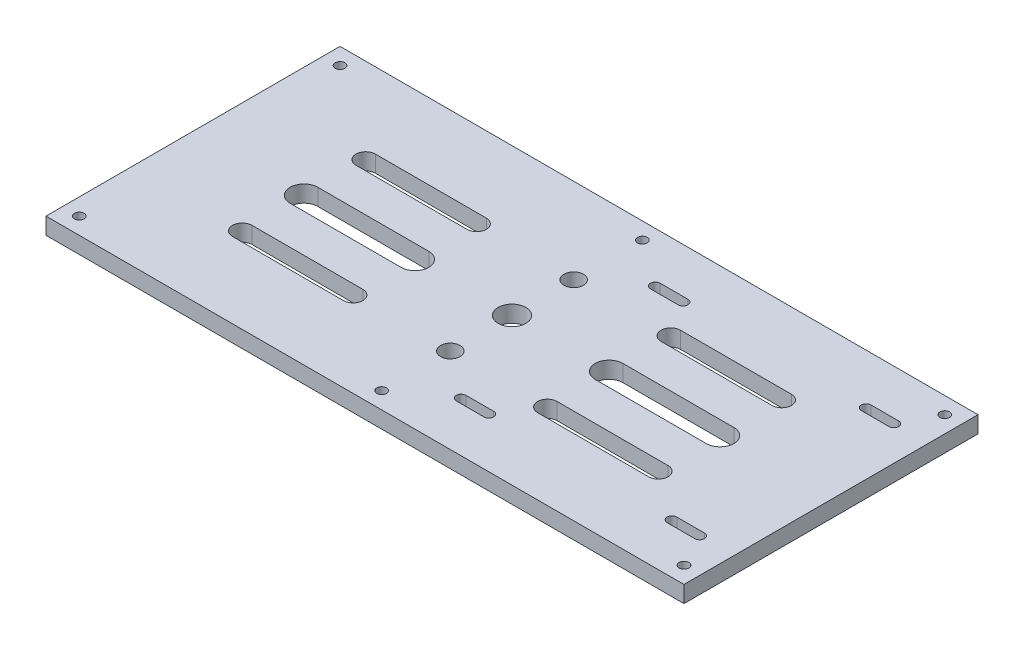
from build123d import *

# Parameters (mm, degrees)
SKETCH1_W           = 230
SKETCH1_H           = 106
SKETCH1_R           = 5
SKETCH1_R_2         = 3.5
SKETCH1_R_3         = 1.75
BOSS_EXTRUDE1_DEPTH = 6


with BuildPart() as part:
    # Sketch1 → Boss-Extrude1 (new body)
    with BuildSketch(Plane(origin=(0, 0, 0), x_dir=(1, 0, 0), z_dir=(0, 1, 0))):
        Rectangle(SKETCH1_W, SKETCH1_H)
        with Locations(Location((0, 0, 0), (0, 0, 270))):
            Circle(SKETCH1_R, mode=Mode.SUBTRACT)
        with Locations(Location((0, 22.25, 0), (0, 0, 270))):
            Circle(SKETCH1_R_2, mode=Mode.SUBTRACT)
        with Locations(Location((0, -22.25, 0), (0, 0, 90))):
            Circle(SKETCH1_R_2, mode=Mode.SUBTRACT)
        with Locations(Location((109, 47, 0), (0, 0, 270))):
            Circle(SKETCH1_R_3, mode=Mode.SUBTRACT)
        with Locations(Location((109, -47, 0), (0, 0, 90))):
            Circle(SKETCH1_R_3, mode=Mode.SUBTRACT)
        with Locations(Location((-109, -47, 0), (0, 0, 270))):
            Circle(SKETCH1_R_3, mode=Mode.SUBTRACT)
        with Locations(Location((-109, 47, 0), (0, 0, 90))):
            Circle(SKETCH1_R_3, mode=Mode.SUBTRACT)
        with Locations(Location((0, 47, 0), (0, 0, 270))):
            Circle(SKETCH1_R_3, mode=Mode.SUBTRACT)
        with Locations(Location((0, -47, 0), (0, 0, 90))):
            Circle(SKETCH1_R_3, mode=Mode.SUBTRACT)
        with BuildLine():
            Line((35, 5), (75, 5))
            ThreePointArc((75, 5), (80, 0), (75, -5))
            Line((75, -5), (35, -5))
            ThreePointArc((35, -5), (30, 0), (35, 5))
        make_face(mode=Mode.SUBTRACT)
        with BuildLine():
            Line((35, 18.75), (75, 18.75))
            ThreePointArc((75, 18.75), (78.5, 22.25), (75, 25.75))
            Line((75, 25.75), (35, 25.75))
            ThreePointArc((35, 25.75), (31.5, 22.25), (35, 18.75))
        make_face(mode=Mode.SUBTRACT)
        with BuildLine():
            Line((16.66, -33.25), (26.66, -33.25))
            ThreePointArc((26.66, -33.25), (28.41, -35), (26.66, -36.75))
            Line((26.66, -36.75), (16.66, -36.75))
            ThreePointArc((16.66, -36.75), (14.91, -35), (16.66, -33.25))
        make_face(mode=Mode.SUBTRACT)
        with BuildLine():
            Line((16.66, 36.75), (26.66, 36.75))
            ThreePointArc((26.66, 36.75), (28.41, 35), (26.66, 33.25))
            Line((26.66, 33.25), (16.66, 33.25))
            ThreePointArc((16.66, 33.25), (14.91, 35), (16.66, 36.75))
        make_face(mode=Mode.SUBTRACT)
        with BuildLine():
            Line((102.66, -33.25), (92.66, -33.25))
            ThreePointArc((92.66, -33.25), (90.91, -35), (92.66, -36.75))
            Line((92.66, -36.75), (102.66, -36.75))
            ThreePointArc((102.66, -36.75), (104.41, -35), (102.66, -33.25))
        make_face(mode=Mode.SUBTRACT)
        with BuildLine():
            Line((102.66, 33.25), (92.66, 33.25))
            ThreePointArc((92.66, 33.25), (90.91, 35), (92.66, 36.75))
            Line((92.66, 36.75), (102.66, 36.75))
            ThreePointArc((102.66, 36.75), (104.41, 35), (102.66, 33.25))
        make_face(mode=Mode.SUBTRACT)
        with BuildLine():
            Line((35, -18.75), (75, -18.75))
            ThreePointArc((75, -18.75), (78.5, -22.25), (75, -25.75))
            Line((75, -25.75), (35, -25.75))
            ThreePointArc((35, -25.75), (31.5, -22.25), (35, -18.75))
        make_face(mode=Mode.SUBTRACT)
        with BuildLine():
            Line((-35, 18.75), (-75, 18.75))
            ThreePointArc((-75, 18.75), (-78.5, 22.25), (-75, 25.75))
            Line((-75, 25.75), (-35, 25.75))
            ThreePointArc((-35, 25.75), (-31.5, 22.25), (-35, 18.75))
        make_face(mode=Mode.SUBTRACT)
        with BuildLine():
            Line((-35, -5), (-75, -5))
            ThreePointArc((-75, -5), (-80, 0), (-75, 5))
            Line((-75, 5), (-35, 5))
            ThreePointArc((-35, 5), (-30, 0), (-35, -5))
        make_face(mode=Mode.SUBTRACT)
        with BuildLine():
            Line((-35, -18.75), (-75, -18.75))
            ThreePointArc((-75, -18.75), (-78.5, -22.25), (-75, -25.75))
            Line((-75, -25.75), (-35, -25.75))
            ThreePointArc((-35, -25.75), (-31.5, -22.25), (-35, -18.75))
        make_face(mode=Mode.SUBTRACT)
    extrude(amount=BOSS_EXTRUDE1_DEPTH)


solid = part.part
